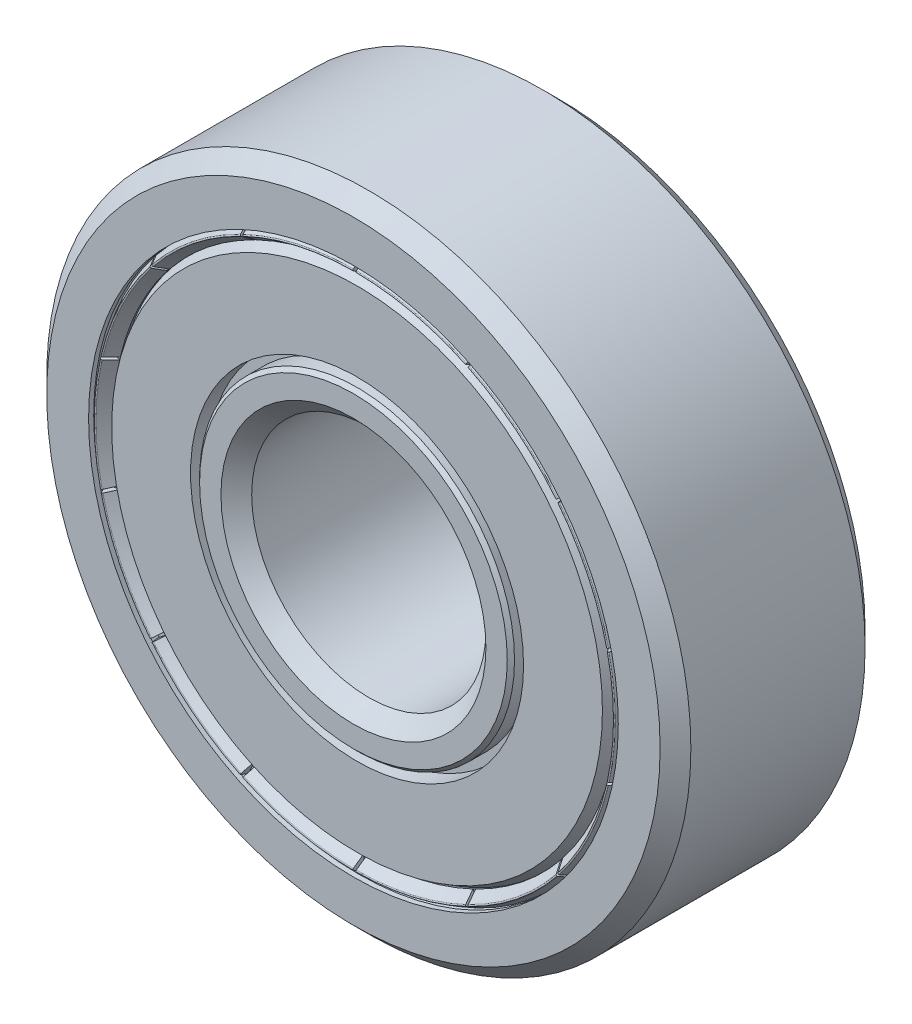
from build123d import *

# Parameters (mm, degrees)
CIRPATTERN1_COUNT  = 7
FILLET1_R          = 0.035
CUT_EXTRUDE1_START = 3.094142
CUT_EXTRUDE1_DEPTH = 13.851076719
CIRPATTERN2_COUNT  = 14


with BuildPart() as part:
    # Sketch3 → Revolve1 (revolve)
    with BuildSketch(Plane(origin=(0, 0, 0), x_dir=(0, 0, -1), z_dir=(1, 0, 0)), mode=Mode.PRIVATE) as revolve1_sk:
        with BuildLine():
            Line((2.975, 11), (-2.975, 11))
            Line((-2.975, 11), (-3.5, 10.475))
            Line((-3.5, 10.475), (-3.5, 9.046037105))
            Line((-3.5, 9.046037105), (-3.325, 9.046037105))
            Line((-3.325, 9.046037105), (-3.325, 9.498018553))
            Line((-3.325, 9.498018553), (-3.201256313, 9.621762239))
            Line((-3.201256313, 9.621762239), (-1.225, 9.621762239))
            ThreePointArc((-1.225, 9.621762239), (0, 9.95), (1.225, 9.621762239))
            Line((1.225, 9.621762239), (3.201256313, 9.621762239))
            Line((3.201256313, 9.621762239), (3.325, 9.498018553))
            Line((3.325, 9.498018553), (3.325, 9.046037105))
            Line((3.325, 9.046037105), (3.5, 9.046037105))
            Line((3.5, 9.046037105), (3.5, 10.475))
            Line((3.5, 10.475), (2.975, 11))
        make_face()
        with BuildLine():
            Line((2.975, 4), (-2.975, 4))
            Line((-2.975, 4), (-3.5, 4.525))
            Line((-3.5, 4.525), (-3.5, 5.254494074))
            Line((-3.5, 5.254494074), (-3.376256313, 5.378237761))
            Line((-3.376256313, 5.378237761), (-1.225, 5.378237761))
            ThreePointArc((-1.225, 5.378237761), (0, 5.05), (1.225, 5.378237761))
            Line((1.225, 5.378237761), (3.376256313, 5.378237761))
            Line((3.376256313, 5.378237761), (3.5, 5.254494074))
            Line((3.5, 5.254494074), (3.5, 4.525))
            Line((3.5, 4.525), (2.975, 4))
        make_face()
    revolve(revolve1_sk.sketch.rotate(Axis((0, 0, 3.5), (0, 0, -1)), 90), axis=Axis((0, 0, 3.5), (0, 0, -1)))


with BuildPart() as body_2:
    # Sketch4 → Revolve2 (revolve)
    with BuildSketch(Plane(origin=(0, 0, 0), x_dir=(0, 0, -1), z_dir=(1, 0, 0))):
        with BuildLine():
            Line((0, 9.95), (0, 5.05))
            ThreePointArc((0, 5.05), (-2.45, 7.5), (0, 9.95))
        make_face()
    revolve(axis=Axis((0, 11, 0), (0, -1, 0)))


with BuildPart() as cirpattern1_1:
    # CirPattern1: pattern copy
    add(body_2.part.rotate(Axis((0, 0, 0), (0, 0, 1)), 1 * 360 / CIRPATTERN1_COUNT))


with BuildPart() as cirpattern1_2:
    # CirPattern1: pattern copy
    add(body_2.part.rotate(Axis((0, 0, 0), (0, 0, 1)), 2 * 360 / CIRPATTERN1_COUNT))


with BuildPart() as cirpattern1_3:
    # CirPattern1: pattern copy
    add(body_2.part.rotate(Axis((0, 0, 0), (0, 0, 1)), 3 * 360 / CIRPATTERN1_COUNT))


with BuildPart() as cirpattern1_4:
    # CirPattern1: pattern copy
    add(body_2.part.rotate(Axis((0, 0, 0), (0, 0, 1)), 4 * 360 / CIRPATTERN1_COUNT))


with BuildPart() as cirpattern1_5:
    # CirPattern1: pattern copy
    add(body_2.part.rotate(Axis((0, 0, 0), (0, 0, 1)), 5 * 360 / CIRPATTERN1_COUNT))


with BuildPart() as cirpattern1_6:
    # CirPattern1: pattern copy
    add(body_2.part.rotate(Axis((0, 0, 0), (0, 0, 1)), 6 * 360 / CIRPATTERN1_COUNT))


with BuildPart() as body_9:
    # Sketch5 → Revolve3 (revolve)
    with BuildSketch(Plane(origin=(0, 0, 0), x_dir=(0, 0, -1), z_dir=(1, 0, 0)), mode=Mode.PRIVATE) as revolve3_sk:
        Polygon((-2.45, 5.378237761), (-2.758752104, 5.378237761), (-2.758752104, 5.686989865), (-3.376256313, 5.686989865), (-3.376256313, 8.380768779), (-2.758752104, 8.737285001), (-2.45, 8.737285001), align=None)
        Polygon((2.758752104, 8.737285001), (2.45, 8.737285001), (2.45, 5.378237761), (2.758752104, 5.378237761), (2.758752104, 5.686989865), (3.376256313, 5.686989865), (3.376256313, 8.380768779), align=None)
    revolve(revolve3_sk.sketch.rotate(Axis((0, 0, 3.5), (0, 0, -1)), 90), axis=Axis((0, 0, 3.5), (0, 0, -1)))


with BuildPart() as body_10:
    # Sketch6 → Revolve4 (revolve)
    with BuildSketch(Plane(origin=(0, 0, 0), x_dir=(0, 0, -1), z_dir=(1, 0, 0)), mode=Mode.PRIVATE) as revolve4_sk:
        Polygon((-2.994533294, 9.046037105), (-3.19375, 9.046037105), (-3.5, 8.869223585), (-3.099533294, 8.588813779), (-3.064533294, 8.588813779), (-2.994533294, 8.601156667), align=None)
    revolve(revolve4_sk.sketch.rotate(Axis((0, 0, 3.5), (0, 0, -1)), 90), axis=Axis((0, 0, 3.5), (0, 0, -1)))

    # Fillet1
    fillet1_edges = [body_10.edges().sort_by_distance(p)[0] for p in [
        (-8.869223585, 0, 3.5),
    ]]
    fillet(fillet1_edges, radius=FILLET1_R)

    # Sketch7 → Cut-Extrude1 (cut, through all)
    with BuildSketch(Plane.XY.offset(CUT_EXTRUDE1_START)):
        Polygon((-0.05, 9.046037105), (-0.05, 9.146037105), (0.05, 9.146037105), (0.05, 9.046037105), (0.05, 8.588813779), (0.05, 8.488813779), (-0.05, 8.488813779), (-0.05, 8.588813779), align=None)
    cut_extrude1 = extrude(amount=CUT_EXTRUDE1_DEPTH, mode=Mode.SUBTRACT)

    # CirPattern2: Cut-Extrude1 ×14 about axis
    cirpattern2_axis = Axis((0, 0, 3.5), (0, 0, -1))
    for i in range(1, CIRPATTERN2_COUNT):
        add(cut_extrude1.rotate(cirpattern2_axis, i * 360 / CIRPATTERN2_COUNT), mode=Mode.SUBTRACT)


with BuildPart() as body_11:
    # Mirror1: mirrored copy
    add(body_10.part.mirror(Plane.XY))


solid = Compound([part.part, body_2.part, cirpattern1_1.part, cirpattern1_2.part, cirpattern1_3.part, cirpattern1_4.part, cirpattern1_5.part, cirpattern1_6.part, body_9.part, body_10.part, body_11.part])
